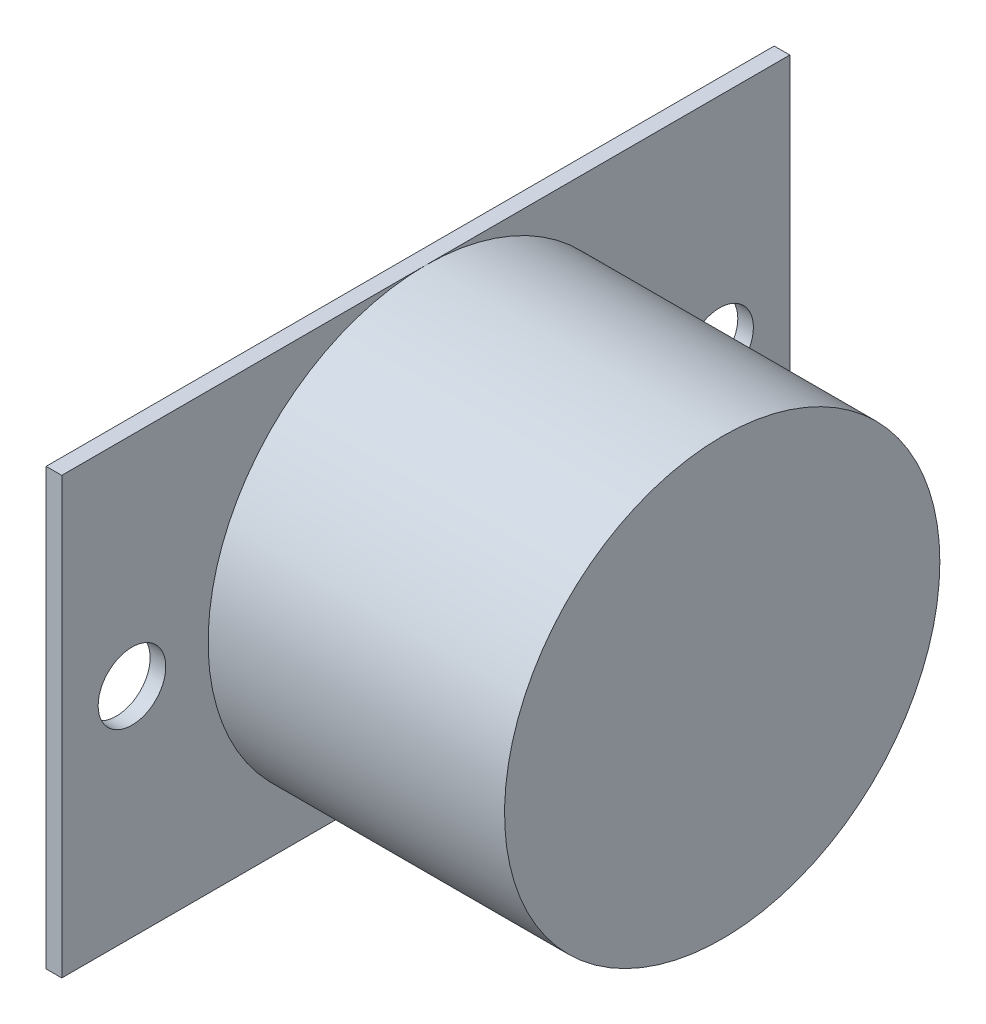
from build123d import *

# Parameters (mm, degrees)
SKETCH1_R           = 20.926913159
BOSS_EXTRUDE2_DEPTH = 30
SKETCH3_W           = 70
SKETCH3_H           = 41.853826318
BOSS_EXTRUDE3_DEPTH = 1.5
SKETCH4_R           = 3.25
CUT_EXTRUDE1_DEPTH  = 1.5


with BuildPart() as part:
    # Sketch1 → Boss-Extrude2 (new body)
    with BuildSketch(Plane(origin=(0, 0, 0), x_dir=(0, 0, -1), z_dir=(1, 0, 0))):
        Circle(SKETCH1_R)
    extrude(amount=BOSS_EXTRUDE2_DEPTH)

    # Sketch3 → Boss-Extrude3 (add)
    with BuildSketch(Plane.ZY):
        Rectangle(SKETCH3_W, SKETCH3_H)
    extrude(amount=-BOSS_EXTRUDE3_DEPTH)

    # Sketch4 → Cut-Extrude1 (cut)
    with BuildSketch(Plane.ZY):
        with Locations((28.25, 0)):
            Circle(SKETCH4_R)
        with Locations(Location((-28.25, 0, 0), (0, 0, 180))):
            Circle(SKETCH4_R)
    extrude(amount=-CUT_EXTRUDE1_DEPTH, mode=Mode.SUBTRACT)


solid = part.part
